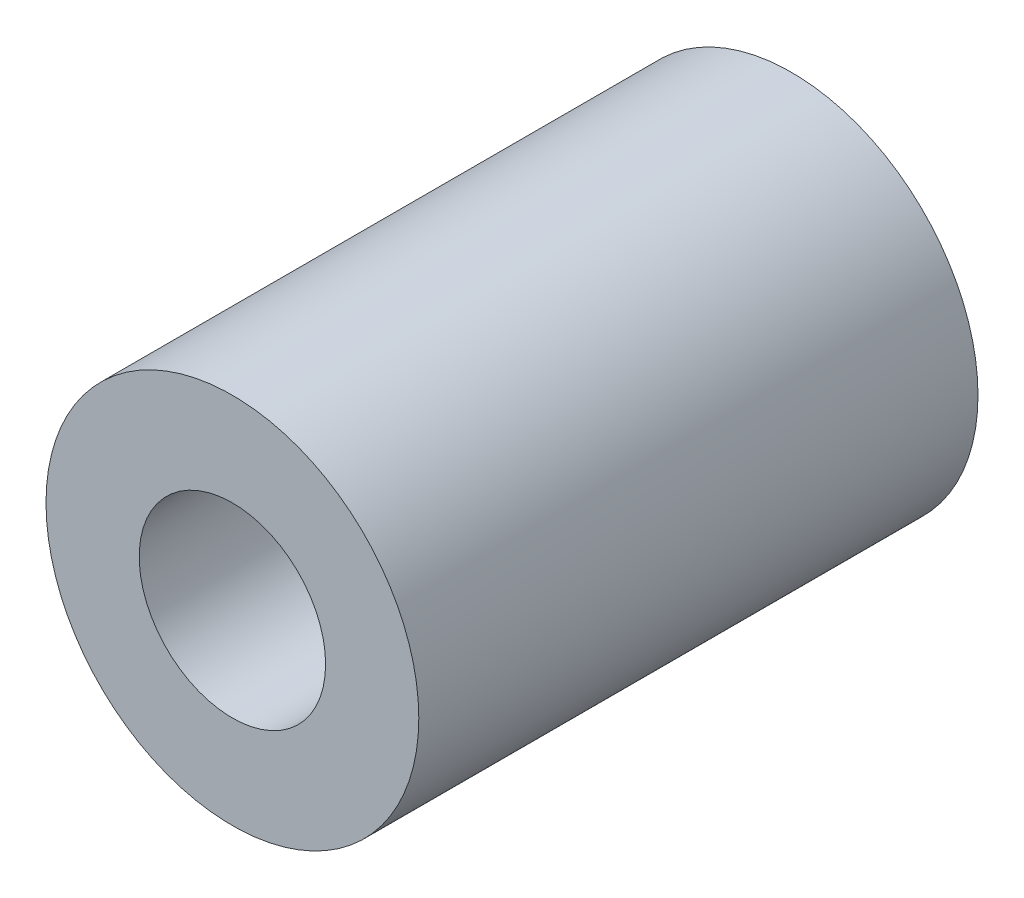
from build123d import *

# Parameters (mm, degrees)
SKETCH_2_R      = 3
SKETCH_2_R_2    = 1.5
EXTRUDE_1_DEPTH = 9


with BuildPart() as part:
    # 草图2 → 凸台-拉伸1 (new body)
    with BuildSketch(Plane.XY):
        Circle(SKETCH_2_R)
        Circle(SKETCH_2_R_2, mode=Mode.SUBTRACT)
    extrude(amount=EXTRUDE_1_DEPTH)


solid = part.part
